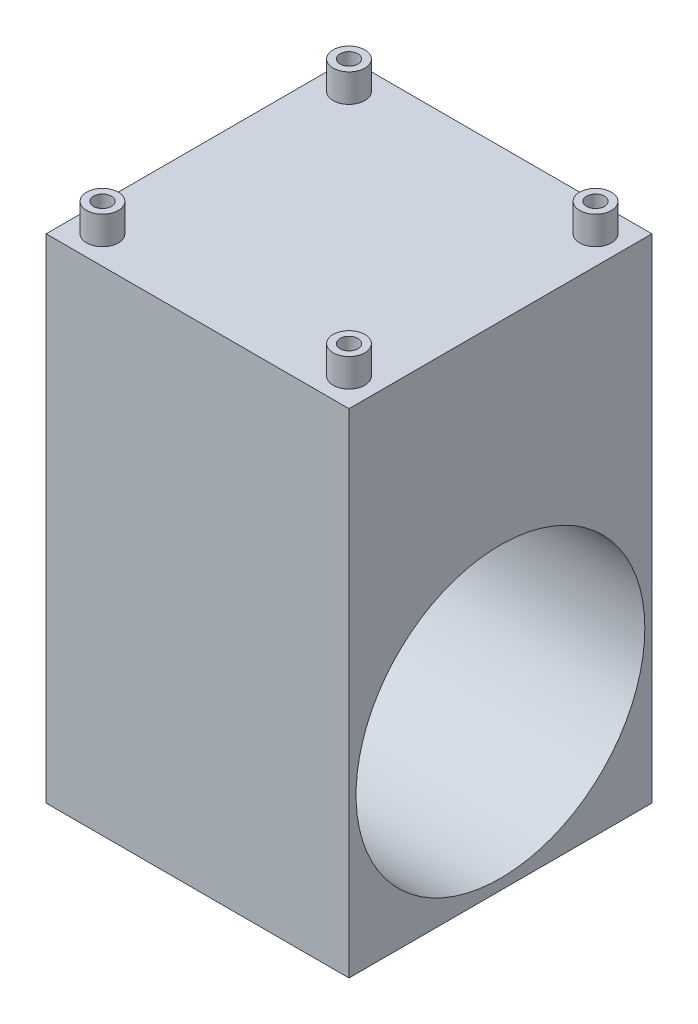
from build123d import *

# Parameters (mm, degrees)
SKETCH1_W           = 43
SKETCH1_H           = 43
BOSS_EXTRUDE1_DEPTH = 70
SKETCH2_R           = 20.5
CUT_EXTRUDE1_DEPTH  = 40
SKETCH3_R           = 2.25
SKETCH3_R_2         = 1.27
BOSS_EXTRUDE2_DEPTH = 4


with BuildPart() as part:
    # Sketch1 → Boss-Extrude1 (new body)
    with BuildSketch(Plane(origin=(0, 0, 0), x_dir=(1, 0, 0), z_dir=(0, 1, 0))):
        Rectangle(SKETCH1_W, SKETCH1_H)
    extrude(amount=BOSS_EXTRUDE1_DEPTH)

    # Sketch2 → Cut-Extrude1 (cut)
    with BuildSketch(Plane(origin=(21.5, 0, 0), x_dir=(0, 0, -1), z_dir=(1, 0, 0))):
        with Locations((0, 22)):
            Circle(SKETCH2_R)
    extrude(amount=-CUT_EXTRUDE1_DEPTH, mode=Mode.SUBTRACT)

    # Sketch3 → Boss-Extrude2 (add)
    # profile 1 of 4: a face of its own
    with BuildSketch(Plane(origin=(0, 70, 0), x_dir=(1, 0, 0), z_dir=(0, 1, 0))):
        with Locations(Location((17.5, 17.5, 0), (0, 0, 270))):
            Circle(SKETCH3_R)
        with Locations(Location((17.5, 17.5, 0), (0, 0, 270))):
            Circle(SKETCH3_R_2, mode=Mode.SUBTRACT)
    # profile 2 of 4: a face of its own
    with BuildSketch(Plane(origin=(0, 70, 0), x_dir=(1, 0, 0), z_dir=(0, 1, 0))):
        with Locations(Location((-17.5, 17.5, 0), (0, 0, 270))):
            Circle(SKETCH3_R)
        with Locations(Location((-17.5, 17.5, 0), (0, 0, 270))):
            Circle(SKETCH3_R_2, mode=Mode.SUBTRACT)
    # profile 3 of 4: a face of its own
    with BuildSketch(Plane(origin=(0, 70, 0), x_dir=(1, 0, 0), z_dir=(0, 1, 0))):
        with Locations(Location((-17.5, -17.5, 0), (0, 0, 270))):
            Circle(SKETCH3_R)
        with Locations(Location((-17.5, -17.5, 0), (0, 0, 270))):
            Circle(SKETCH3_R_2, mode=Mode.SUBTRACT)
    # profile 4 of 4: a face of its own
    with BuildSketch(Plane(origin=(0, 70, 0), x_dir=(1, 0, 0), z_dir=(0, 1, 0))):
        with Locations(Location((17.5, -17.5, 0), (0, 0, 270))):
            Circle(SKETCH3_R)
        with Locations(Location((17.5, -17.5, 0), (0, 0, 270))):
            Circle(SKETCH3_R_2, mode=Mode.SUBTRACT)
    extrude(amount=BOSS_EXTRUDE2_DEPTH)


solid = part.part
